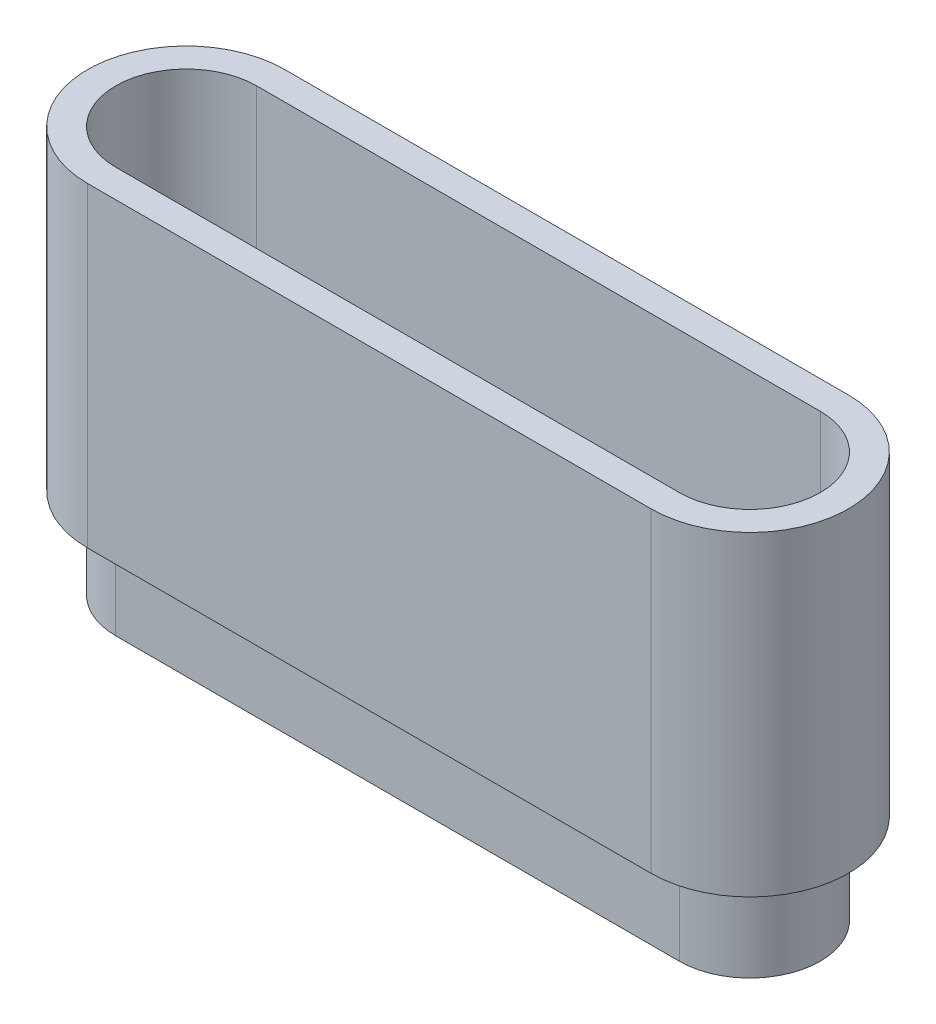
from build123d import *

# Parameters (mm, degrees)
EXTRUDE_2_DEPTH = 16
EXTRUDE_1_DEPTH = 56


with BuildPart() as part:
    # 草图1 → 凸台-拉伸2 (new body)
    with BuildSketch(Plane(origin=(0, 0, 0), x_dir=(1, 0, 0), z_dir=(0, 1, 0))):
        with BuildLine():
            Line((0, 12.5), (100, 12.5))
            ThreePointArc((100, 12.5), (112.5, 0), (100, -12.5))
            Line((100, -12.5), (0, -12.5))
            ThreePointArc((0, -12.5), (-12.5, 0), (0, 12.5))
        make_face()
    extrude(amount=EXTRUDE_2_DEPTH)


with BuildPart() as body_2:
    # 草图5 → 拉伸-薄壁1 (new body)
    with BuildSketch(Plane(origin=(0, 16, 0), x_dir=(1, 0, 0), z_dir=(0, 1, 0))):
        with BuildLine():
            Line((100, 17.5), (0, 17.5))
            ThreePointArc((0, 17.5), (-17.5, 0), (0, -17.5))
            Line((0, -17.5), (100, -17.5))
            ThreePointArc((100, -17.5), (117.5, 0), (100, 17.5))
        make_face()
        with BuildLine():
            Line((100, 12.5), (0, 12.5))
            ThreePointArc((0, 12.5), (-12.5, 0), (0, -12.5))
            Line((0, -12.5), (100, -12.5))
            ThreePointArc((100, -12.5), (112.5, 0), (100, 12.5))
        make_face(mode=Mode.SUBTRACT)
    extrude(amount=EXTRUDE_1_DEPTH)


solid = Compound([part.part, body_2.part])
